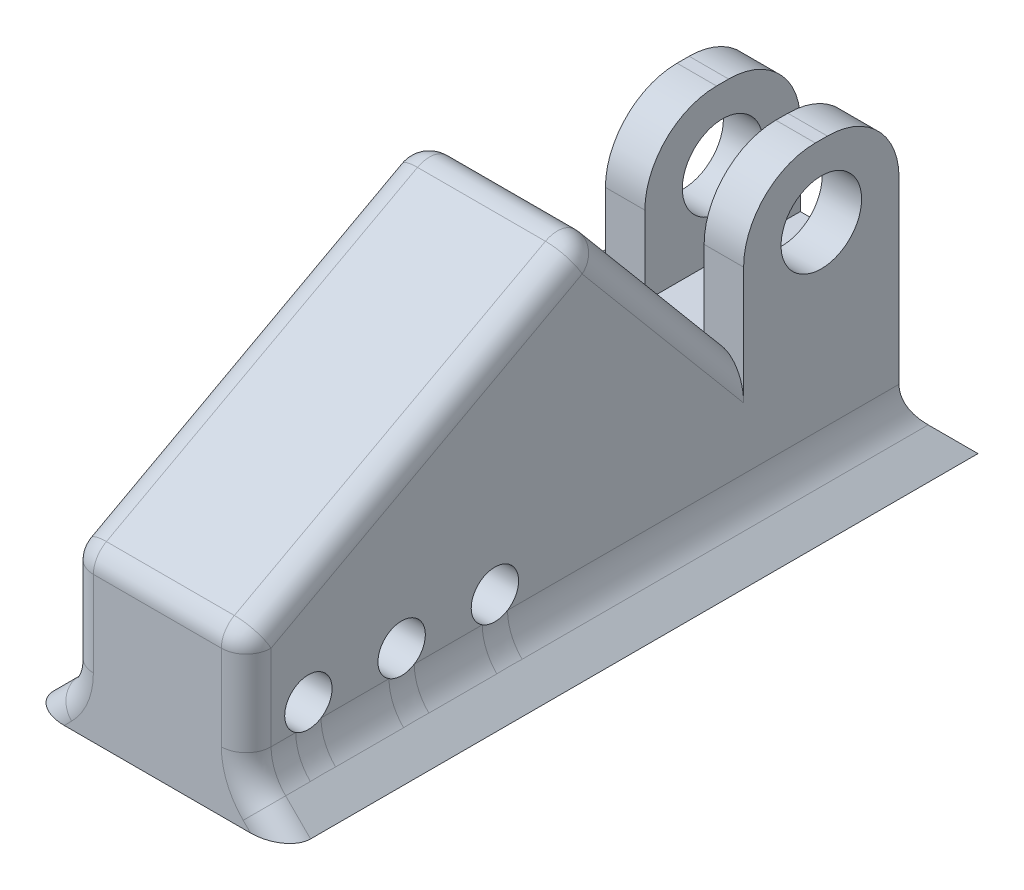
from build123d import *

# Parameters (mm, degrees)
SKETCH1_W                       = 28.58
SKETCH1_H                       = 50
BOSS_EXTRUDE1_DEPTH             = 12.5
SKETCH2_W                       = 9.53
SKETCH2_H                       = 24.225
SKETCH2_W_2                     = 6.35
CUT_EXTRUDE1_DEPTH              = 39.134028111
FILLET1_R                       = 11.53
SKETCH3_R                       = 6.477
CUT_EXTRUDE2_DEPTH              = 40.975822693
BOSS_EXTRUDE2_DEPTH             = 28.58
SKETCH5_W                       = 28.58
SKETCH5_H                       = 25.775
BOSS_EXTRUDE3_DEPTH             = 80
CUT_EXTRUDE3_DEPTH              = 100.990331533
CUT_EXTRUDE3_DEPTH_BACK         = 100.990331533
SKETCH6_R                       = 3.81
BOSS_EXTRUDE4_REACH             = 110.877
BOSS_EXTRUDE4_DIRECTION_2_REACH = 110.877
TROUS_DE_CENTRAGE_5_0MM1_D      = 5
TROUS_DE_CENTRAGE_5_0MM1_DEPTH  = 10
TROUS_DE_CENTRAGE_5_0MM1_TIP    = 1.502151548
BOSS_EXTRU_1_REACH              = 103.987
FILLET2_R                       = 8
FILLET4_R                       = 4


with BuildPart() as part:
    # Sketch1 → Boss-Extrude1 (new, symmetric)
    with BuildSketch(Plane.XY):
        Rectangle(SKETCH1_W, SKETCH1_H)
    extrude(amount=BOSS_EXTRUDE1_DEPTH, both=True)

    # Sketch2 → Cut-Extrude1 (cut, through all)
    with BuildSketch(Plane(origin=(0, 0, 12.5), x_dir=(-1, 0, 0), z_dir=(0, 0, 1))):
        with Locations((-3.175, -12.8875)):
            Rectangle(SKETCH2_W, SKETCH2_H)
        with Locations((11.115, -12.8875)):
            Rectangle(SKETCH2_W_2, SKETCH2_H)
    extrude(amount=-CUT_EXTRUDE1_DEPTH, mode=Mode.SUBTRACT)

    # Fillet1
    fillet1_edges = [part.edges().sort_by_distance(p)[0] for p in [
        (-4.765, 25, -12.5),
        (-4.765, 25, 12.5),
        (11.115, 25, -12.5),
        (11.115, 25, 12.5),
    ]]
    fillet(fillet1_edges, radius=FILLET1_R)

    # Sketch3 → Cut-Extrude2 (cut, through all)
    with BuildSketch(Plane(origin=(14.29, 0, 0), x_dir=(0, 0, -1), z_dir=(1, 0, 0))):
        with Locations(Location((0, 13.47, 0), (0, 0, 270))):
            Circle(SKETCH3_R)
    extrude(amount=-CUT_EXTRUDE2_DEPTH, mode=Mode.SUBTRACT)

    # Sketch4 → Boss-Extrude2 (add)
    with BuildSketch(Plane(origin=(14.29, 0, 0), x_dir=(0, 0, -1), z_dir=(1, 0, 0))):
        Polygon((18.85, -25), (12.5, -18.65), (12.5, -25), align=None)
    extrude(amount=-BOSS_EXTRUDE2_DEPTH)

    # Sketch5 → Boss-Extrude3 (add)
    with BuildSketch(Plane.XY.offset(12.5)):
        with Locations((0, -12.1125)):
            Rectangle(SKETCH5_W, SKETCH5_H)
    extrude(amount=BOSS_EXTRUDE3_DEPTH)

    # Sketch6 → Cut-Extrude3 (cut, two sides: drawn at the far end of the back side and taken through both)
    with BuildSketch(Plane(origin=(14.29, 0, 0), x_dir=(0, 0, -1), z_dir=(1, 0, 0)).offset(-CUT_EXTRUDE3_DEPTH_BACK)):
        with Locations((-82.5, -12.1125)):
            Circle(SKETCH6_R)
        with Locations((-67.5, -12.1125)):
            Circle(SKETCH6_R)
        with Locations((-52.5, -12.1125)):
            Circle(SKETCH6_R)
    extrude(amount=CUT_EXTRUDE3_DEPTH + CUT_EXTRUDE3_DEPTH_BACK, mode=Mode.SUBTRACT)

    # Boss-Extrude4: up to this face of the body (flat: up to its plane)
    boss_extrude4_end = Plane(part.part.faces().sort_by_distance((0, -12.1125, 92.5))[0])
    # Sketch7 → Boss-Extrude4 (add, up to the picked face)
    with BuildSketch(Plane(origin=(0, 0, -12.5), x_dir=(-1, 0, 0), z_dir=(0, 0, -1)), mode=Mode.PRIVATE) as boss_extrude4_sk1:
        Polygon((-14.29, -25), (-20.64, -25), (-14.29, -18.65), align=None)
    boss_extrude4_tool1 = split(extrude(boss_extrude4_sk1.sketch, amount=-BOSS_EXTRUDE4_REACH, mode=Mode.PRIVATE), bisect_by=boss_extrude4_end, keep=Keep.BOTH, mode=Mode.PRIVATE)
    boss_extrude4 = boss_extrude4_tool1.solids().sort_by(Axis((16.406667, -22.883333, -12.5), (0, 0, 1)))[0]
    add(boss_extrude4)

    # Boss-Extrude4 direction 2: up to this face of the body (flat: up to its plane)
    boss_extrude4_direction_2_end = Plane(part.part.faces().sort_by_distance((0, -21.825, -15.675))[0])
    # Sketch7 → Boss-Extrude4 direction 2 (add, up to the picked face)
    with BuildSketch(Plane(origin=(0, 0, -12.5), x_dir=(-1, 0, 0), z_dir=(0, 0, -1)), mode=Mode.PRIVATE) as boss_extrude4_direction_2_sk1:
        Polygon((-14.29, -25), (-20.64, -25), (-14.29, -18.65), align=None)
    boss_extrude4_direction_2_tool1 = split(extrude(boss_extrude4_direction_2_sk1.sketch, amount=BOSS_EXTRUDE4_DIRECTION_2_REACH, mode=Mode.PRIVATE), bisect_by=boss_extrude4_direction_2_end, keep=Keep.BOTH, mode=Mode.PRIVATE)
    boss_extrude4_direction_2 = boss_extrude4_direction_2_tool1.solids().sort_by(Axis((16.406667, -22.883333, -12.5), (0, 0, -1)))[0]
    add(boss_extrude4_direction_2)

    # Mirror2: Boss-Extrude4, Boss-Extrude4 direction 2 across plane
    add(boss_extrude4.mirror(Plane(origin=(0, 0, 0), x_dir=(0, 0, 1), z_dir=(1, 0, 0))))
    add(boss_extrude4_direction_2.mirror(Plane(origin=(0, 0, 0), x_dir=(0, 0, 1), z_dir=(1, 0, 0))))

    # Trous de centrage Ø5.0mm1
    with Locations(Plane(origin=(0, -25, 0), x_dir=(-1, 0, 0), z_dir=(0, -1, 0))):
        with Locations((-7.5, 0.534345417), (7.5, 0.534345417), (7.5, -14.465654583), (-7.5, -14.465654583), (-7.5, -29.465654583), (7.5, -29.465654583), (7.5, -44.465654583), (-7.5, -44.465654583)):
            Hole(TROUS_DE_CENTRAGE_5_0MM1_D / 2, depth=TROUS_DE_CENTRAGE_5_0MM1_DEPTH)
            with Locations((0, 0, -(TROUS_DE_CENTRAGE_5_0MM1_DEPTH + TROUS_DE_CENTRAGE_5_0MM1_TIP / 2))):  # 118° drill point
                Cone(0, TROUS_DE_CENTRAGE_5_0MM1_D / 2, TROUS_DE_CENTRAGE_5_0MM1_TIP, mode=Mode.SUBTRACT)

    # Boss.-Extru.1: up to this face of the body (flat: up to its plane)
    boss_extru_1_end = Plane(part.part.faces().sort_by_distance((-14.29, -8.709219679, 38.022768873))[0])
    # Esquisse1 → Boss.-Extru.1 (add, up to the picked face)
    with BuildSketch(Plane(origin=(14.29, 0, 0), x_dir=(0, 0, -1), z_dir=(1, 0, 0)), mode=Mode.PRIVATE) as boss_extru_1_sk1:
        Polygon((-37.5, 30.568839815), (-12.5, 0.775), (-92.5, 0.775), align=None)
    boss_extru_1_tool1 = split(extrude(boss_extru_1_sk1.sketch, amount=-BOSS_EXTRU_1_REACH, mode=Mode.PRIVATE), bisect_by=boss_extru_1_end, keep=Keep.BOTH, mode=Mode.PRIVATE)
    add(boss_extru_1_tool1.solids().sort_by(Axis((14.29, 10.70628, 47.5), (-1, 0, 0)))[0])

    # Fillet2
    fillet2_edges = [part.edges().sort_by_distance(p)[0] for p in [
        (14.29, -18.65, 40),
        (-14.29, -18.65, 40),
        (0, -18.65, -12.5),
    ]]
    fillet(fillet2_edges, radius=FILLET2_R)

    # Fillet4
    fillet4_edges = [part.edges().sort_by_distance(p)[0] for p in [
        (18.636572875, -22.996572875, 92.5),
        (-18.636572875, -22.996572875, 92.5),
        (0, 30.568839815, 37.5),
        (14.29, 15.671919907, 65),
        (14.29, 15.671919907, 25),
        (-14.29, 15.671919907, 65),
        (-14.29, 15.671919907, 25),
        (14.29, -7.280645751, 92.5),
        (-14.89896374, -18.39775896, 92.5),
        (14.89896374, -18.39775896, 92.5),
        (-14.29, 0.775, 0),
        (-14.29, -7.280645751, 92.5),
        (0, 0.775, 92.5),
    ]]
    fillet(fillet4_edges, radius=FILLET4_R)


solid = part.part
